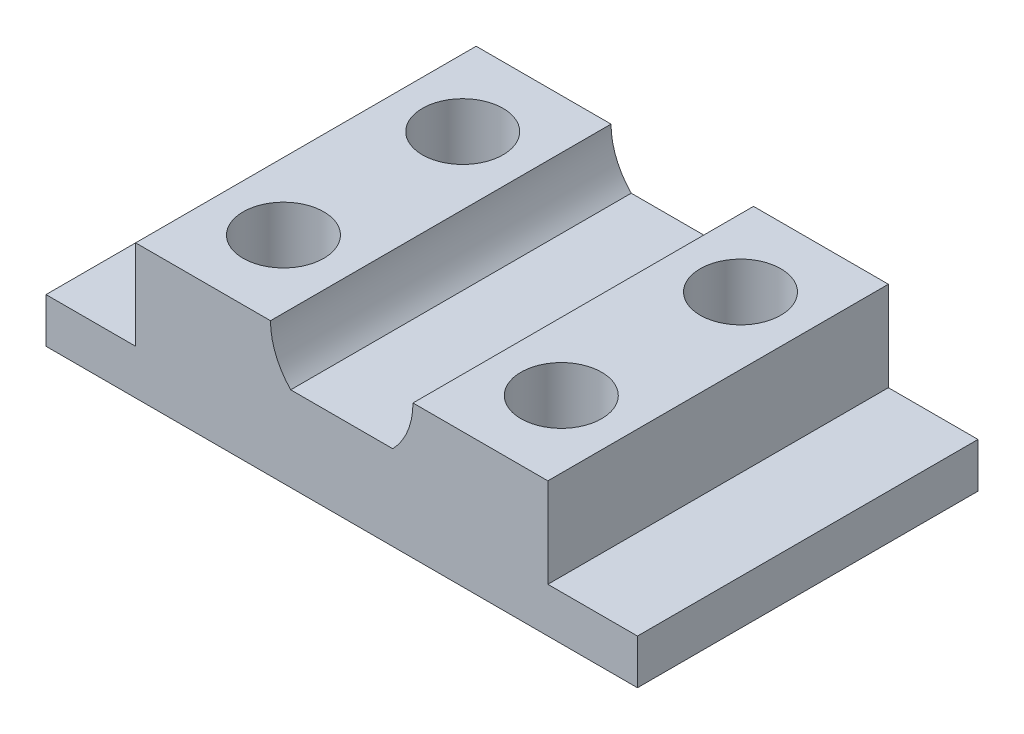
from build123d import *

# Parameters (mm, degrees)
SKETCH1_W              = 46
SKETCH1_H              = 38
BOSS_EXTRUDE1_DEPTH    = 15
M10X1_0_TAPPED_HOLE1_D = 9
SKETCH7_R              = 7.95
CUT_EXTRUDE1_DEPTH     = 62.522353661
SKETCH17_W             = 38
SKETCH17_H             = 5
BOSS_EXTRUDE2_DEPTH    = 10
SKETCH18_W             = 38
SKETCH18_H             = 5
BOSS_EXTRUDE3_DEPTH    = 10
SKETCH24_W             = 18.029816061
SKETCH24_H             = 38
BOSS_EXTRUDE4_DEPTH    = 6


with BuildPart() as part:
    # Sketch1 → Boss-Extrude1 (new body)
    with BuildSketch(Plane(origin=(0, 0, 0), x_dir=(1, 0, 0), z_dir=(0, 1, 0))):
        with Locations((23, 19)):
            Rectangle(SKETCH1_W, SKETCH1_H)
    extrude(amount=BOSS_EXTRUDE1_DEPTH)

    # M10x1.0 Tapped Hole1 (through all)
    with Locations(Plane(origin=(0, 15, 0), x_dir=(1, 0, 0), z_dir=(0, 1, 0))):
        with Locations((7.5, 29), (38.5, 29), (38.5, 9), (7.5, 9)):
            Hole(M10X1_0_TAPPED_HOLE1_D / 2)

    # Sketch7 → Cut-Extrude1 (cut, through all)
    with BuildSketch(Plane.XY):
        with Locations((23, 15)):
            Circle(SKETCH7_R)
    extrude(amount=-CUT_EXTRUDE1_DEPTH, mode=Mode.SUBTRACT)

    # Sketch17 → Boss-Extrude2 (add)
    with BuildSketch(Plane(origin=(46, 0, 0), x_dir=(0, 0, -1), z_dir=(1, 0, 0))):
        with Locations((19, 2.5)):
            Rectangle(SKETCH17_W, SKETCH17_H)
    extrude(amount=BOSS_EXTRUDE2_DEPTH)

    # Sketch18 → Boss-Extrude3 (add)
    with BuildSketch(Plane.ZY):
        with Locations((-19, 2.5)):
            Rectangle(SKETCH18_W, SKETCH18_H)
    extrude(amount=BOSS_EXTRUDE3_DEPTH)

    # Sketch24 → Boss-Extrude4 (add)
    with BuildSketch(Plane(origin=(0, 9.45, 0), x_dir=(1, 0, 0), z_dir=(0, 1, 0))):
        with Locations((23.165854861, 19)):
            Rectangle(SKETCH24_W, SKETCH24_H)
    extrude(amount=-BOSS_EXTRUDE4_DEPTH)


solid = part.part
